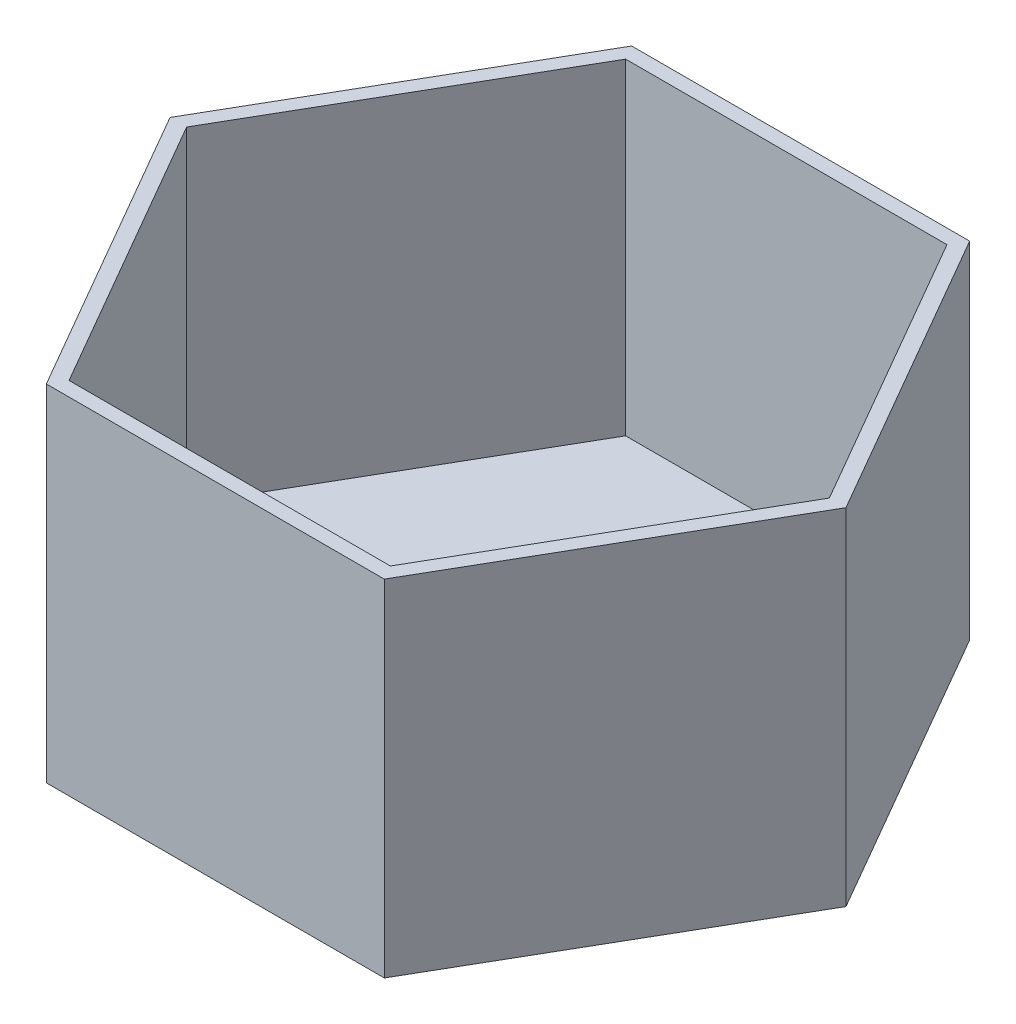
from build123d import *

# Parameters (mm, degrees)
BOSS_EXTRUDE1_DEPTH = 72
CUT_EXTRUDE1_DEPTH  = 68
SKETCH4_R           = 27.5
BOSS_EXTRUDE2_DEPTH = 5


with BuildPart() as part:
    # Sketch2 → Boss-Extrude1 (new body)
    with BuildSketch(Plane(origin=(0, 0, 0), x_dir=(1, 0, 0), z_dir=(0, 1, 0))):
        Polygon((70.436732841, 0), (35.218366421, 61), (-35.218366421, 61), (-70.436732841, 0), (-35.218366421, -61), (35.218366421, -61), align=None)
    extrude(amount=BOSS_EXTRUDE1_DEPTH)

    # Sketch3 → Cut-Extrude1 (cut)
    with BuildSketch(Plane(origin=(0, 72, 0), x_dir=(1, 0, 0), z_dir=(0, 1, 0))):
        Polygon((66.972631226, 0), (33.486315613, 58), (-33.486315613, 58), (-66.972631226, 0), (-33.486315613, -58), (33.486315613, -58), align=None)
    extrude(amount=-CUT_EXTRUDE1_DEPTH, mode=Mode.SUBTRACT)

    # Sketch4 → Boss-Extrude2 (add)
    with BuildSketch(Plane(origin=(0, 4, 0), x_dir=(1, 0, 0), z_dir=(0, 1, 0))):
        with Locations(Location((0, 0, 0), (0, 0, 270))):
            Circle(SKETCH4_R)
    extrude(amount=BOSS_EXTRUDE2_DEPTH)


solid = part.part
